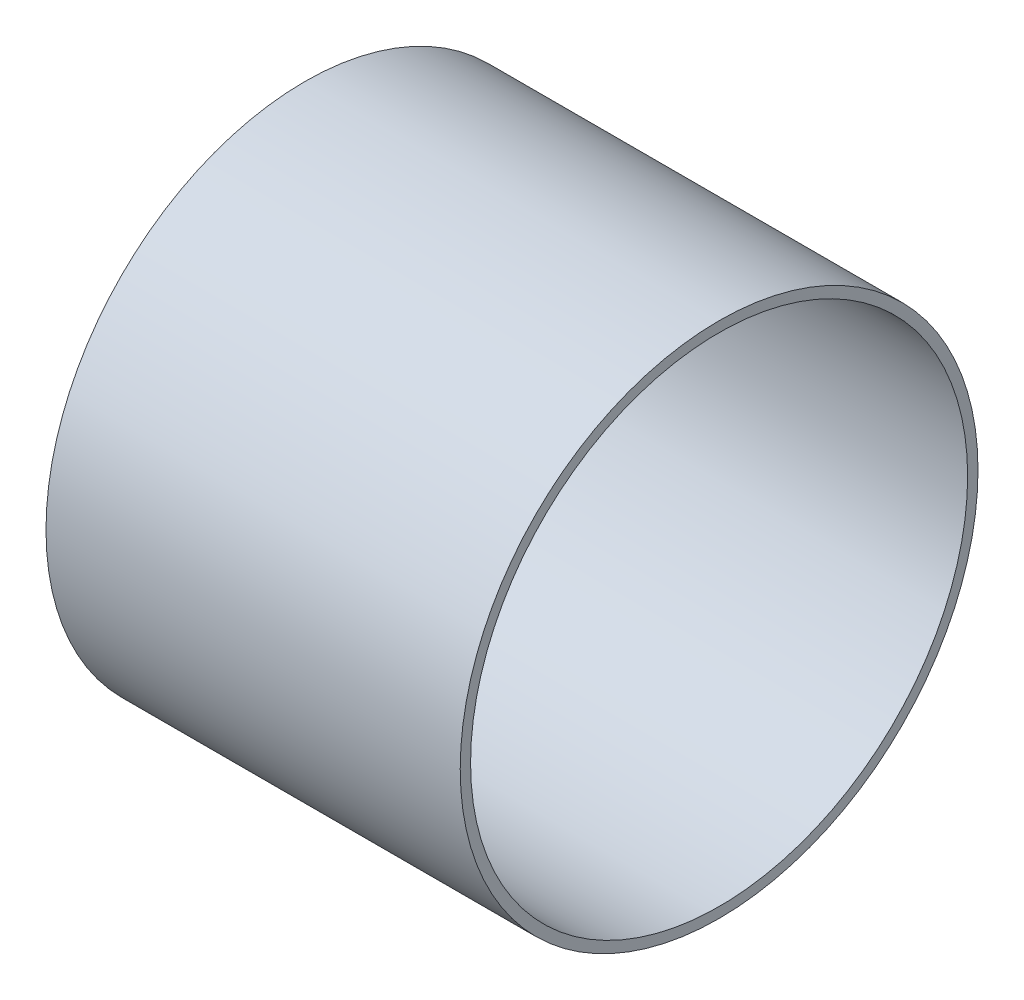
from build123d import *

# Parameters (mm, degrees)
SKETCH1_R           = 25
BOSS_EXTRUDE1_DEPTH = 40
SKETCH2_R           = 24
CUT_EXTRUDE1_DEPTH  = 54.38539126


with BuildPart() as part:
    # Sketch1 → Boss-Extrude1 (new body)
    with BuildSketch(Plane(origin=(0, 0, 0), x_dir=(0, 0, -1), z_dir=(1, 0, 0))):
        Circle(SKETCH1_R)
    extrude(amount=-BOSS_EXTRUDE1_DEPTH)

    # Sketch2 → Cut-Extrude1 (cut, through all)
    with BuildSketch(Plane(origin=(0, 0, 0), x_dir=(0, 0, -1), z_dir=(1, 0, 0))):
        Circle(SKETCH2_R)
    extrude(amount=-CUT_EXTRUDE1_DEPTH, mode=Mode.SUBTRACT)


solid = part.part
